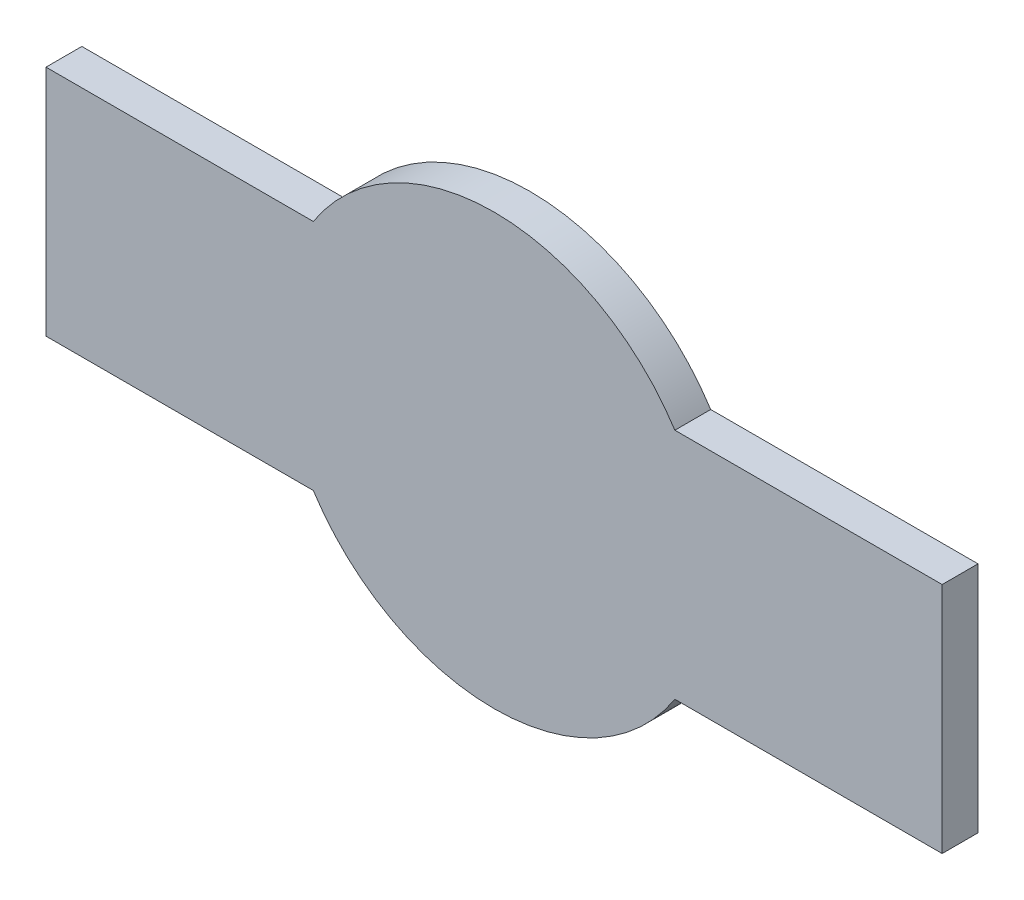
from build123d import *

# Parameters (mm, degrees)
ESQUISSE1_R        = 60
ESQUISSE1_W        = 250
ESQUISSE1_H        = 65
BOSS_EXTRU_1_DEPTH = 10


with BuildPart() as part:
    # Esquisse1 → Boss.-Extru.1 (new body)
    with BuildSketch(Plane.XY):
        Circle(ESQUISSE1_R)
        Rectangle(ESQUISSE1_W, ESQUISSE1_H)
    extrude(amount=BOSS_EXTRU_1_DEPTH)


solid = part.part
